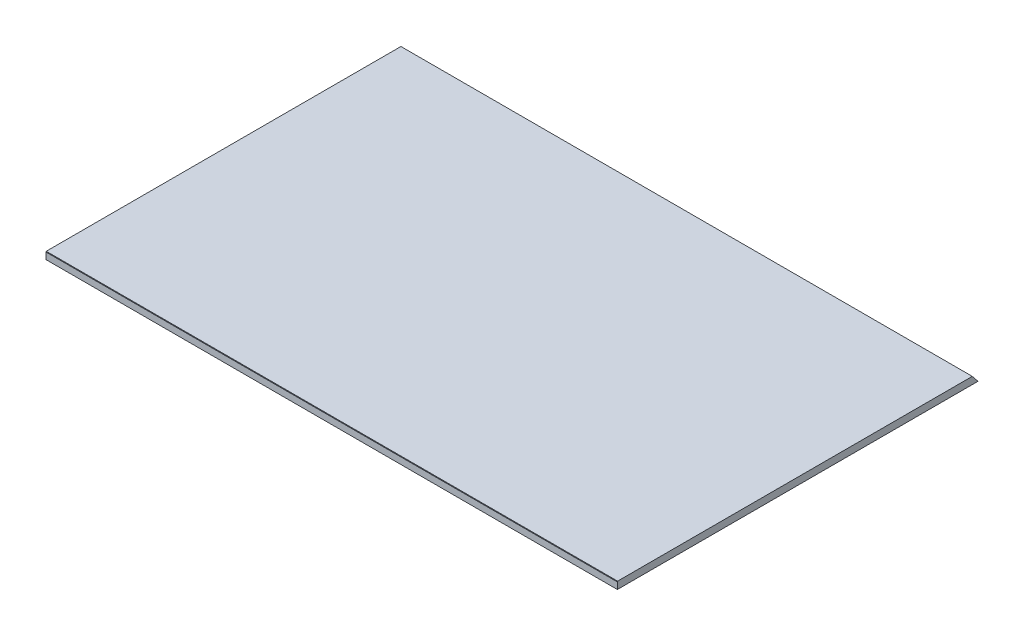
from build123d import *

# Parameters (mm, degrees)
BOSS_EXTRUDE2_DEPTH      = 160
CUT_EXTRUDE11_DEPTH      = 201.089979759
CUT_EXTRUDE11_DEPTH_BACK = 201.089979759
SKETCH12_W               = 233
SKETCH12_H               = 21
CUT_EXTRUDE12_DEPTH      = 2
SKETCH13_W               = 7
SKETCH13_H               = 23
BOSS_EXTRUDE3_DEPTH      = 2
CUT_EXTRUDE13_DEPTH      = 324.208910768
CUT_EXTRUDE13_DEPTH_BACK = 324.208910768


with BuildPart() as part:
    # Sketch8 → Boss-Extrude2 (new, symmetric)
    with BuildSketch(Plane(origin=(0, 0, 0), x_dir=(0, 0, -1), z_dir=(1, 0, 0))):
        Polygon((-88.104080333, -6), (62.895919667, -6), (80.895919667, -3.176729887), (80.976403784, -2.998472611), (82.781317846, 0.999074726), (78.781317846, 5.999074726), (-119.85604145, 6), (-120, 5.68), (-120, 1.998947428), (-106.104080333, -6), align=None)
    extrude(amount=BOSS_EXTRUDE2_DEPTH, both=True)

    # Sketch9 → Cut-Extrude11 (cut, two sides: drawn at the far end of the back side and taken through both)
    with BuildSketch(Plane.XY.offset(-CUT_EXTRUDE11_DEPTH_BACK)):
        Polygon((-160, -6), (-142, -6), (-160, 1.998947428), align=None)
        Polygon((160, -6), (142, -6), (160, 1.998947428), align=None)
    extrude(amount=CUT_EXTRUDE11_DEPTH + CUT_EXTRUDE11_DEPTH_BACK, mode=Mode.SUBTRACT)

    # Sketch12 → Cut-Extrude12 (cut)
    with BuildSketch(Plane.XZ.offset(6)):
        with Locations((1.5, -28.395919667)):
            Rectangle(SKETCH12_W, SKETCH12_H)
    extrude(amount=-CUT_EXTRUDE12_DEPTH, mode=Mode.SUBTRACT)

    # Sketch13 → Boss-Extrude3 (add)
    with BuildSketch(Plane.XZ.offset(6)):
        with Locations((-136.5, 92.604080333)):
            Rectangle(SKETCH13_W, SKETCH13_H)
        with Locations((-136.5, -49.395919667)):
            Rectangle(SKETCH13_W, SKETCH13_H)
        with Locations((136.5, -49.395919667)):
            Rectangle(SKETCH13_W, SKETCH13_H)
        with Locations((136.5, 92.604080333)):
            Rectangle(SKETCH13_W, SKETCH13_H)
    extrude(amount=BOSS_EXTRUDE3_DEPTH)

    # Sketch14 → Cut-Extrude13 (cut, two sides: drawn at the far end of the back side and taken through both)
    with BuildSketch(Plane.ZY.offset(140).offset(-CUT_EXTRUDE13_DEPTH_BACK)):
        Polygon((-60.895919667, -8), (-54.223413834, -8), (-60.895919667, -6), align=None)
        Polygon((104.104080333, -8), (96.367273939, -8), (104.104080333, -6), align=None)
        Polygon((81.104080333, -8), (81.104080333, -6), (87.367273939, -8), align=None)
        Polygon((-45.223413834, -8), (-37.895919667, -6), (-37.895919667, -8), align=None)
    extrude(amount=CUT_EXTRUDE13_DEPTH + CUT_EXTRUDE13_DEPTH_BACK, mode=Mode.SUBTRACT)


solid = part.part
